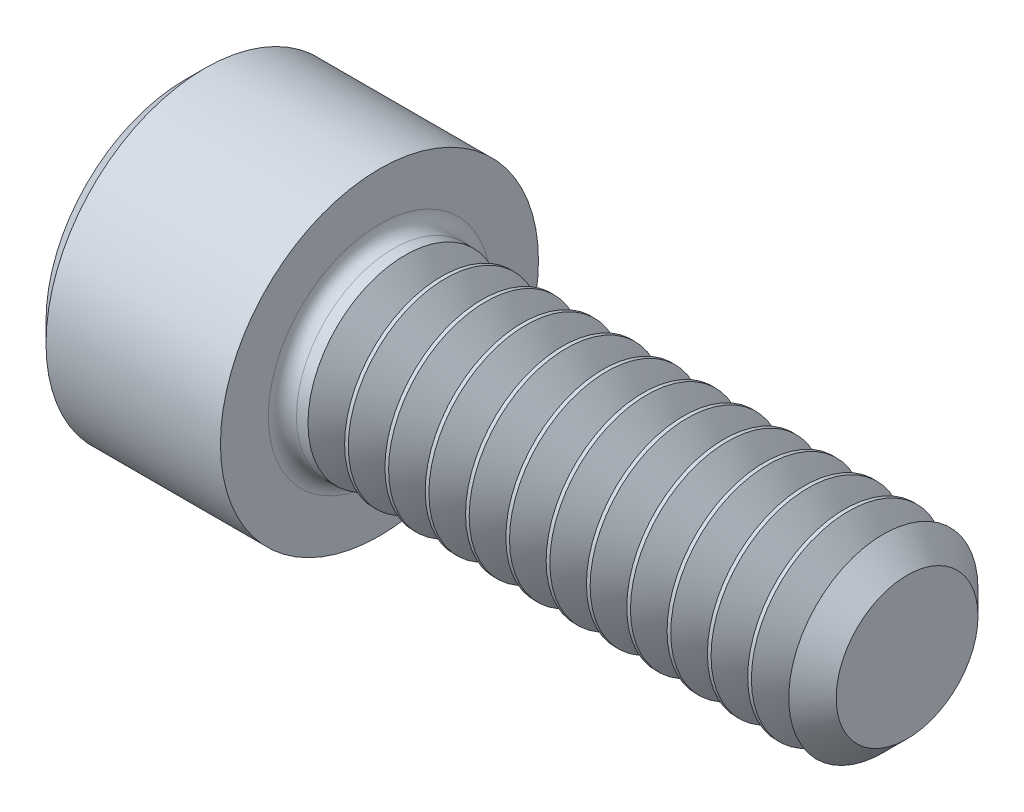
from build123d import *

# Parameters (mm, degrees)
SKETCH1_W            = 3.5052
SKETCH1_H            = 2.8702
SKETCH2_R            = 1.7526
BOSS_EXTRUDE1_DEPTH  = 0.461673951
SKETCH3_R            = 1.7526
BOSS_EXTRUDE2_DEPTH  = 0.330806049
BOSS_EXTRUDE2_TAPER  = 54.999999998
SKETCH4_R            = 1.28016
BOSS_EXTRUDE3_DEPTH  = 0.330806049
BOSS_EXTRUDE3_DRAFT  = -55
SKETCH5_R            = 1.7526
BOSS_EXTRUDE4_DEPTH  = 0.066097901
SKETCH6_R            = 1.7526
BOSS_EXTRUDE5_DEPTH  = 0.330806049
BOSS_EXTRUDE5_TAPER  = 54.999999998
SKETCH7_R            = 1.28016
BOSS_EXTRUDE6_DEPTH  = 0.330806049
BOSS_EXTRUDE6_DRAFT  = -55
SKETCH8_R            = 1.7526
BOSS_EXTRUDE7_DEPTH  = 0.066097901
SKETCH9_R            = 1.7526
BOSS_EXTRUDE8_DEPTH  = 0.330806049
BOSS_EXTRUDE8_TAPER  = 54.999999998
SKETCH10_R           = 1.28016
BOSS_EXTRUDE9_DEPTH  = 0.330806049
BOSS_EXTRUDE9_DRAFT  = -55
SKETCH11_R           = 1.7526
BOSS_EXTRUDE10_DEPTH = 0.066097901
SKETCH12_R           = 1.7526
BOSS_EXTRUDE11_DEPTH = 0.330806049
BOSS_EXTRUDE11_TAPER = 54.999999998
SKETCH13_R           = 1.28016
BOSS_EXTRUDE12_DEPTH = 0.330806049
BOSS_EXTRUDE12_DRAFT = -55
SKETCH14_R           = 1.7526
BOSS_EXTRUDE13_DEPTH = 0.066097901
SKETCH15_R           = 1.7526
BOSS_EXTRUDE14_DEPTH = 0.330806049
BOSS_EXTRUDE14_TAPER = 54.999999998
SKETCH16_R           = 1.28016
BOSS_EXTRUDE15_DEPTH = 0.330806049
BOSS_EXTRUDE15_DRAFT = -55
SKETCH17_R           = 1.7526
BOSS_EXTRUDE16_DEPTH = 0.066097901
SKETCH18_R           = 1.7526
BOSS_EXTRUDE17_DEPTH = 0.330806049
BOSS_EXTRUDE17_TAPER = 54.999999998
SKETCH19_R           = 1.28016
BOSS_EXTRUDE18_DEPTH = 0.330806049
BOSS_EXTRUDE18_DRAFT = -55
SKETCH20_R           = 1.7526
BOSS_EXTRUDE19_DEPTH = 0.066097901
SKETCH21_R           = 1.7526
BOSS_EXTRUDE20_DEPTH = 0.330806049
BOSS_EXTRUDE20_TAPER = 54.999999998
SKETCH22_R           = 1.28016
BOSS_EXTRUDE21_DEPTH = 0.330806049
BOSS_EXTRUDE21_DRAFT = -55
SKETCH23_R           = 1.7526
BOSS_EXTRUDE22_DEPTH = 0.066097901
SKETCH24_R           = 1.7526
BOSS_EXTRUDE23_DEPTH = 0.330806049
BOSS_EXTRUDE23_TAPER = 54.999999998
SKETCH25_R           = 1.28016
BOSS_EXTRUDE24_DEPTH = 0.330806049
BOSS_EXTRUDE24_DRAFT = -55.000000004
SKETCH26_R           = 1.7526
BOSS_EXTRUDE25_DEPTH = 0.066097901
SKETCH27_R           = 1.7526
BOSS_EXTRUDE26_DEPTH = 0.330806049
BOSS_EXTRUDE26_TAPER = 54.999999998
SKETCH28_R           = 1.28016
BOSS_EXTRUDE27_DEPTH = 0.330806049
BOSS_EXTRUDE27_DRAFT = -55
SKETCH29_R           = 1.7526
BOSS_EXTRUDE28_DEPTH = 0.066097901
SKETCH30_R           = 1.7526
BOSS_EXTRUDE29_DEPTH = 0.330806049
BOSS_EXTRUDE29_TAPER = 54.999999998
SKETCH31_R           = 1.28016
BOSS_EXTRUDE30_DEPTH = 0.330806049
BOSS_EXTRUDE30_DRAFT = -55.000000004
SKETCH32_R           = 1.7526
BOSS_EXTRUDE31_DEPTH = 0.066097901
SKETCH33_R           = 1.7526
BOSS_EXTRUDE32_DEPTH = 0.330806049
BOSS_EXTRUDE32_TAPER = 54.999999998
SKETCH34_R           = 1.28016
BOSS_EXTRUDE33_DEPTH = 0.330806049
BOSS_EXTRUDE33_DRAFT = -55.000000004
SKETCH35_R           = 1.7526
BOSS_EXTRUDE34_DEPTH = 0.066097901
SKETCH36_R           = 1.7526
BOSS_EXTRUDE35_DEPTH = 0.330806049
BOSS_EXTRUDE35_TAPER = 54.999999998
SKETCH37_R           = 1.28016
BOSS_EXTRUDE36_DEPTH = 0.299697546
BOSS_EXTRUDE36_DRAFT = -55.000000002
SKETCH38_R           = 1.708172454
BOSS_EXTRUDE37_DEPTH = 0.428012454
BOSS_EXTRUDE37_TAPER = 45
CUT_EXTRUDE1_DEPTH   = 1.6256
CHAMFER1_SIZE        = 0.3556
FILLET1_R            = 0.254


with BuildPart() as part:
    # Sketch1 → Revolve1 (revolve)
    with BuildSketch(Plane(origin=(0, 0, 0), x_dir=(-1, 0, 0), z_dir=(0, 0, -1)), mode=Mode.PRIVATE) as revolve1_sk:
        with Locations((-1.7526, 1.4351)):
            Rectangle(SKETCH1_W, SKETCH1_H)
    revolve(revolve1_sk.sketch.rotate(Axis((3.5052, 0, 0), (-1, 0, 0)), 270), axis=Axis((3.5052, 0, 0), (-1, 0, 0)))

    # Sketch2 → Boss-Extrude1 (add)
    with BuildSketch(Plane(origin=(3.5052, 0, 0), x_dir=(0, 0, -1), z_dir=(1, 0, 0))):
        Circle(SKETCH2_R)
    extrude(amount=BOSS_EXTRUDE1_DEPTH)

    # Sketch3 → Boss-Extrude2 (add)
    with BuildSketch(Plane(origin=(3.966873951, 0, 0), x_dir=(0, 0, -1), z_dir=(1, 0, 0))):
        Circle(SKETCH3_R)
    extrude(amount=BOSS_EXTRUDE2_DEPTH, taper=BOSS_EXTRUDE2_TAPER)


with BuildPart() as boss_extrude3_tool:
    # Sketch4 → Boss-Extrude3 (with draft: the straight prism first)
    with BuildSketch(Plane(origin=(4.29768, 0, 0), x_dir=(0, 0, -1), z_dir=(1, 0, 0))):
        Circle(SKETCH4_R)
    extrude(amount=BOSS_EXTRUDE3_DEPTH)
    # Boss-Extrude3: the draft: its side faces are tilted about the plane it starts from
    boss_extrude3_sides = [boss_extrude3_tool.faces().sort_by_distance(p)[0] for p in [
        (4.463083025, 0, 1.28016),
    ]]
    draft(boss_extrude3_sides, Plane(origin=(4.29768, 0, 0), x_dir=(0, 0, -1), z_dir=(1, 0, 0)), BOSS_EXTRUDE3_DRAFT)


with BuildPart() as part_1:
    add(part.part)

    # Boss-Extrude3: add boss_extrude3_tool
    add(boss_extrude3_tool.part)

    # Sketch5 → Boss-Extrude4 (add)
    with BuildSketch(Plane(origin=(4.628486049, 0, 0), x_dir=(0, 0, -1), z_dir=(1, 0, 0))):
        Circle(SKETCH5_R)
    extrude(amount=BOSS_EXTRUDE4_DEPTH)

    # Sketch6 → Boss-Extrude5 (add)
    with BuildSketch(Plane(origin=(4.694583951, 0, 0), x_dir=(0, 0, -1), z_dir=(1, 0, 0))):
        Circle(SKETCH6_R)
    extrude(amount=BOSS_EXTRUDE5_DEPTH, taper=BOSS_EXTRUDE5_TAPER)


with BuildPart() as boss_extrude6_tool:
    # Sketch7 → Boss-Extrude6 (with draft: the straight prism first)
    with BuildSketch(Plane(origin=(5.02539, 0, 0), x_dir=(0, 0, -1), z_dir=(1, 0, 0))):
        Circle(SKETCH7_R)
    extrude(amount=BOSS_EXTRUDE6_DEPTH)
    # Boss-Extrude6: the draft: its side faces are tilted about the plane it starts from
    boss_extrude6_sides = [boss_extrude6_tool.faces().sort_by_distance(p)[0] for p in [
        (5.190793025, 0, 1.28016),
    ]]
    draft(boss_extrude6_sides, Plane(origin=(5.02539, 0, 0), x_dir=(0, 0, -1), z_dir=(1, 0, 0)), BOSS_EXTRUDE6_DRAFT)


with BuildPart() as part_2:
    add(part_1.part)

    # Boss-Extrude6: add boss_extrude6_tool
    add(boss_extrude6_tool.part)

    # Sketch8 → Boss-Extrude7 (add)
    with BuildSketch(Plane(origin=(5.356196049, 0, 0), x_dir=(0, 0, -1), z_dir=(1, 0, 0))):
        Circle(SKETCH8_R)
    extrude(amount=BOSS_EXTRUDE7_DEPTH)

    # Sketch9 → Boss-Extrude8 (add)
    with BuildSketch(Plane(origin=(5.422293951, 0, 0), x_dir=(0, 0, -1), z_dir=(1, 0, 0))):
        Circle(SKETCH9_R)
    extrude(amount=BOSS_EXTRUDE8_DEPTH, taper=BOSS_EXTRUDE8_TAPER)


with BuildPart() as boss_extrude9_tool:
    # Sketch10 → Boss-Extrude9 (with draft: the straight prism first)
    with BuildSketch(Plane(origin=(5.7531, 0, 0), x_dir=(0, 0, -1), z_dir=(1, 0, 0))):
        Circle(SKETCH10_R)
    extrude(amount=BOSS_EXTRUDE9_DEPTH)
    # Boss-Extrude9: the draft: its side faces are tilted about the plane it starts from
    boss_extrude9_sides = [boss_extrude9_tool.faces().sort_by_distance(p)[0] for p in [
        (5.918503025, 0, 1.28016),
    ]]
    draft(boss_extrude9_sides, Plane(origin=(5.7531, 0, 0), x_dir=(0, 0, -1), z_dir=(1, 0, 0)), BOSS_EXTRUDE9_DRAFT)


with BuildPart() as part_3:
    add(part_2.part)

    # Boss-Extrude9: add boss_extrude9_tool
    add(boss_extrude9_tool.part)

    # Sketch11 → Boss-Extrude10 (add)
    with BuildSketch(Plane(origin=(6.083906049, 0, 0), x_dir=(0, 0, -1), z_dir=(1, 0, 0))):
        Circle(SKETCH11_R)
    extrude(amount=BOSS_EXTRUDE10_DEPTH)

    # Sketch12 → Boss-Extrude11 (add)
    with BuildSketch(Plane(origin=(6.150003951, 0, 0), x_dir=(0, 0, -1), z_dir=(1, 0, 0))):
        Circle(SKETCH12_R)
    extrude(amount=BOSS_EXTRUDE11_DEPTH, taper=BOSS_EXTRUDE11_TAPER)


with BuildPart() as boss_extrude12_tool:
    # Sketch13 → Boss-Extrude12 (with draft: the straight prism first)
    with BuildSketch(Plane(origin=(6.48081, 0, 0), x_dir=(0, 0, -1), z_dir=(1, 0, 0))):
        Circle(SKETCH13_R)
    extrude(amount=BOSS_EXTRUDE12_DEPTH)
    # Boss-Extrude12: the draft: its side faces are tilted about the plane it starts from
    boss_extrude12_sides = [boss_extrude12_tool.faces().sort_by_distance(p)[0] for p in [
        (6.646213025, 0, 1.28016),
    ]]
    draft(boss_extrude12_sides, Plane(origin=(6.48081, 0, 0), x_dir=(0, 0, -1), z_dir=(1, 0, 0)), BOSS_EXTRUDE12_DRAFT)


with BuildPart() as part_4:
    add(part_3.part)

    # Boss-Extrude12: add boss_extrude12_tool
    add(boss_extrude12_tool.part)

    # Sketch14 → Boss-Extrude13 (add)
    with BuildSketch(Plane(origin=(6.811616049, 0, 0), x_dir=(0, 0, -1), z_dir=(1, 0, 0))):
        Circle(SKETCH14_R)
    extrude(amount=BOSS_EXTRUDE13_DEPTH)

    # Sketch15 → Boss-Extrude14 (add)
    with BuildSketch(Plane(origin=(6.877713951, 0, 0), x_dir=(0, 0, -1), z_dir=(1, 0, 0))):
        Circle(SKETCH15_R)
    extrude(amount=BOSS_EXTRUDE14_DEPTH, taper=BOSS_EXTRUDE14_TAPER)


with BuildPart() as boss_extrude15_tool:
    # Sketch16 → Boss-Extrude15 (with draft: the straight prism first)
    with BuildSketch(Plane(origin=(7.20852, 0, 0), x_dir=(0, 0, -1), z_dir=(1, 0, 0))):
        Circle(SKETCH16_R)
    extrude(amount=BOSS_EXTRUDE15_DEPTH)
    # Boss-Extrude15: the draft: its side faces are tilted about the plane it starts from
    boss_extrude15_sides = [boss_extrude15_tool.faces().sort_by_distance(p)[0] for p in [
        (7.373923025, 0, 1.28016),
    ]]
    draft(boss_extrude15_sides, Plane(origin=(7.20852, 0, 0), x_dir=(0, 0, -1), z_dir=(1, 0, 0)), BOSS_EXTRUDE15_DRAFT)


with BuildPart() as part_5:
    add(part_4.part)

    # Boss-Extrude15: add boss_extrude15_tool
    add(boss_extrude15_tool.part)

    # Sketch17 → Boss-Extrude16 (add)
    with BuildSketch(Plane(origin=(7.539326049, 0, 0), x_dir=(0, 0, -1), z_dir=(1, 0, 0))):
        Circle(SKETCH17_R)
    extrude(amount=BOSS_EXTRUDE16_DEPTH)

    # Sketch18 → Boss-Extrude17 (add)
    with BuildSketch(Plane(origin=(7.605423951, 0, 0), x_dir=(0, 0, -1), z_dir=(1, 0, 0))):
        Circle(SKETCH18_R)
    extrude(amount=BOSS_EXTRUDE17_DEPTH, taper=BOSS_EXTRUDE17_TAPER)


with BuildPart() as boss_extrude18_tool:
    # Sketch19 → Boss-Extrude18 (with draft: the straight prism first)
    with BuildSketch(Plane(origin=(7.93623, 0, 0), x_dir=(0, 0, -1), z_dir=(1, 0, 0))):
        Circle(SKETCH19_R)
    extrude(amount=BOSS_EXTRUDE18_DEPTH)
    # Boss-Extrude18: the draft: its side faces are tilted about the plane it starts from
    boss_extrude18_sides = [boss_extrude18_tool.faces().sort_by_distance(p)[0] for p in [
        (8.101633025, 0, 1.28016),
    ]]
    draft(boss_extrude18_sides, Plane(origin=(7.93623, 0, 0), x_dir=(0, 0, -1), z_dir=(1, 0, 0)), BOSS_EXTRUDE18_DRAFT)


with BuildPart() as part_6:
    add(part_5.part)

    # Boss-Extrude18: add boss_extrude18_tool
    add(boss_extrude18_tool.part)

    # Sketch20 → Boss-Extrude19 (add)
    with BuildSketch(Plane(origin=(8.267036049, 0, 0), x_dir=(0, 0, -1), z_dir=(1, 0, 0))):
        Circle(SKETCH20_R)
    extrude(amount=BOSS_EXTRUDE19_DEPTH)

    # Sketch21 → Boss-Extrude20 (add)
    with BuildSketch(Plane(origin=(8.333133951, 0, 0), x_dir=(0, 0, -1), z_dir=(1, 0, 0))):
        Circle(SKETCH21_R)
    extrude(amount=BOSS_EXTRUDE20_DEPTH, taper=BOSS_EXTRUDE20_TAPER)


with BuildPart() as boss_extrude21_tool:
    # Sketch22 → Boss-Extrude21 (with draft: the straight prism first)
    with BuildSketch(Plane(origin=(8.66394, 0, 0), x_dir=(0, 0, -1), z_dir=(1, 0, 0))):
        Circle(SKETCH22_R)
    extrude(amount=BOSS_EXTRUDE21_DEPTH)
    # Boss-Extrude21: the draft: its side faces are tilted about the plane it starts from
    boss_extrude21_sides = [boss_extrude21_tool.faces().sort_by_distance(p)[0] for p in [
        (8.829343025, 0, 1.28016),
    ]]
    draft(boss_extrude21_sides, Plane(origin=(8.66394, 0, 0), x_dir=(0, 0, -1), z_dir=(1, 0, 0)), BOSS_EXTRUDE21_DRAFT)


with BuildPart() as part_7:
    add(part_6.part)

    # Boss-Extrude21: add boss_extrude21_tool
    add(boss_extrude21_tool.part)

    # Sketch23 → Boss-Extrude22 (add)
    with BuildSketch(Plane(origin=(8.994746049, 0, 0), x_dir=(0, 0, -1), z_dir=(1, 0, 0))):
        Circle(SKETCH23_R)
    extrude(amount=BOSS_EXTRUDE22_DEPTH)

    # Sketch24 → Boss-Extrude23 (add)
    with BuildSketch(Plane(origin=(9.060843951, 0, 0), x_dir=(0, 0, -1), z_dir=(1, 0, 0))):
        Circle(SKETCH24_R)
    extrude(amount=BOSS_EXTRUDE23_DEPTH, taper=BOSS_EXTRUDE23_TAPER)


with BuildPart() as boss_extrude24_tool:
    # Sketch25 → Boss-Extrude24 (with draft: the straight prism first)
    with BuildSketch(Plane(origin=(9.39165, 0, 0), x_dir=(0, 0, -1), z_dir=(1, 0, 0))):
        Circle(SKETCH25_R)
    extrude(amount=BOSS_EXTRUDE24_DEPTH)
    # Boss-Extrude24: the draft: its side faces are tilted about the plane it starts from
    boss_extrude24_sides = [boss_extrude24_tool.faces().sort_by_distance(p)[0] for p in [
        (9.557053025, 0, 1.28016),
    ]]
    draft(boss_extrude24_sides, Plane(origin=(9.39165, 0, 0), x_dir=(0, 0, -1), z_dir=(1, 0, 0)), BOSS_EXTRUDE24_DRAFT)


with BuildPart() as part_8:
    add(part_7.part)

    # Boss-Extrude24: add boss_extrude24_tool
    add(boss_extrude24_tool.part)

    # Sketch26 → Boss-Extrude25 (add)
    with BuildSketch(Plane(origin=(9.722456049, 0, 0), x_dir=(0, 0, -1), z_dir=(1, 0, 0))):
        Circle(SKETCH26_R)
    extrude(amount=BOSS_EXTRUDE25_DEPTH)

    # Sketch27 → Boss-Extrude26 (add)
    with BuildSketch(Plane(origin=(9.788553951, 0, 0), x_dir=(0, 0, -1), z_dir=(1, 0, 0))):
        Circle(SKETCH27_R)
    extrude(amount=BOSS_EXTRUDE26_DEPTH, taper=BOSS_EXTRUDE26_TAPER)


with BuildPart() as boss_extrude27_tool:
    # Sketch28 → Boss-Extrude27 (with draft: the straight prism first)
    with BuildSketch(Plane(origin=(10.11936, 0, 0), x_dir=(0, 0, -1), z_dir=(1, 0, 0))):
        Circle(SKETCH28_R)
    extrude(amount=BOSS_EXTRUDE27_DEPTH)
    # Boss-Extrude27: the draft: its side faces are tilted about the plane it starts from
    boss_extrude27_sides = [boss_extrude27_tool.faces().sort_by_distance(p)[0] for p in [
        (10.284763025, 0, 1.28016),
    ]]
    draft(boss_extrude27_sides, Plane(origin=(10.11936, 0, 0), x_dir=(0, 0, -1), z_dir=(1, 0, 0)), BOSS_EXTRUDE27_DRAFT)


with BuildPart() as part_9:
    add(part_8.part)

    # Boss-Extrude27: add boss_extrude27_tool
    add(boss_extrude27_tool.part)

    # Sketch29 → Boss-Extrude28 (add)
    with BuildSketch(Plane(origin=(10.450166049, 0, 0), x_dir=(0, 0, -1), z_dir=(1, 0, 0))):
        Circle(SKETCH29_R)
    extrude(amount=BOSS_EXTRUDE28_DEPTH)

    # Sketch30 → Boss-Extrude29 (add)
    with BuildSketch(Plane(origin=(10.516263951, 0, 0), x_dir=(0, 0, -1), z_dir=(1, 0, 0))):
        Circle(SKETCH30_R)
    extrude(amount=BOSS_EXTRUDE29_DEPTH, taper=BOSS_EXTRUDE29_TAPER)


with BuildPart() as boss_extrude30_tool:
    # Sketch31 → Boss-Extrude30 (with draft: the straight prism first)
    with BuildSketch(Plane(origin=(10.84707, 0, 0), x_dir=(0, 0, -1), z_dir=(1, 0, 0))):
        Circle(SKETCH31_R)
    extrude(amount=BOSS_EXTRUDE30_DEPTH)
    # Boss-Extrude30: the draft: its side faces are tilted about the plane it starts from
    boss_extrude30_sides = [boss_extrude30_tool.faces().sort_by_distance(p)[0] for p in [
        (11.012473025, 0, 1.28016),
    ]]
    draft(boss_extrude30_sides, Plane(origin=(10.84707, 0, 0), x_dir=(0, 0, -1), z_dir=(1, 0, 0)), BOSS_EXTRUDE30_DRAFT)


with BuildPart() as part_10:
    add(part_9.part)

    # Boss-Extrude30: add boss_extrude30_tool
    add(boss_extrude30_tool.part)

    # Sketch32 → Boss-Extrude31 (add)
    with BuildSketch(Plane(origin=(11.177876049, 0, 0), x_dir=(0, 0, -1), z_dir=(1, 0, 0))):
        Circle(SKETCH32_R)
    extrude(amount=BOSS_EXTRUDE31_DEPTH)

    # Sketch33 → Boss-Extrude32 (add)
    with BuildSketch(Plane(origin=(11.243973951, 0, 0), x_dir=(0, 0, -1), z_dir=(1, 0, 0))):
        Circle(SKETCH33_R)
    extrude(amount=BOSS_EXTRUDE32_DEPTH, taper=BOSS_EXTRUDE32_TAPER)


with BuildPart() as boss_extrude33_tool:
    # Sketch34 → Boss-Extrude33 (with draft: the straight prism first)
    with BuildSketch(Plane(origin=(11.57478, 0, 0), x_dir=(0, 0, -1), z_dir=(1, 0, 0))):
        Circle(SKETCH34_R)
    extrude(amount=BOSS_EXTRUDE33_DEPTH)
    # Boss-Extrude33: the draft: its side faces are tilted about the plane it starts from
    boss_extrude33_sides = [boss_extrude33_tool.faces().sort_by_distance(p)[0] for p in [
        (11.740183025, 0, 1.28016),
    ]]
    draft(boss_extrude33_sides, Plane(origin=(11.57478, 0, 0), x_dir=(0, 0, -1), z_dir=(1, 0, 0)), BOSS_EXTRUDE33_DRAFT)


with BuildPart() as part_11:
    add(part_10.part)

    # Boss-Extrude33: add boss_extrude33_tool
    add(boss_extrude33_tool.part)

    # Sketch35 → Boss-Extrude34 (add)
    with BuildSketch(Plane(origin=(11.905586049, 0, 0), x_dir=(0, 0, -1), z_dir=(1, 0, 0))):
        Circle(SKETCH35_R)
    extrude(amount=BOSS_EXTRUDE34_DEPTH)

    # Sketch36 → Boss-Extrude35 (add)
    with BuildSketch(Plane(origin=(11.971683951, 0, 0), x_dir=(0, 0, -1), z_dir=(1, 0, 0))):
        Circle(SKETCH36_R)
    extrude(amount=BOSS_EXTRUDE35_DEPTH, taper=BOSS_EXTRUDE35_TAPER)


with BuildPart() as boss_extrude36_tool:
    # Sketch37 → Boss-Extrude36 (with draft: the straight prism first)
    with BuildSketch(Plane(origin=(12.30249, 0, 0), x_dir=(0, 0, -1), z_dir=(1, 0, 0))):
        Circle(SKETCH37_R)
    extrude(amount=BOSS_EXTRUDE36_DEPTH)
    # Boss-Extrude36: the draft: its side faces are tilted about the plane it starts from
    boss_extrude36_sides = [boss_extrude36_tool.faces().sort_by_distance(p)[0] for p in [
        (12.452338773, 0, 1.28016),
    ]]
    draft(boss_extrude36_sides, Plane(origin=(12.30249, 0, 0), x_dir=(0, 0, -1), z_dir=(1, 0, 0)), BOSS_EXTRUDE36_DRAFT)


with BuildPart() as part_12:
    add(part_11.part)

    # Boss-Extrude36: add boss_extrude36_tool
    add(boss_extrude36_tool.part)

    # Sketch38 → Boss-Extrude37 (add)
    with BuildSketch(Plane(origin=(12.602187546, 0, 0), x_dir=(0, 0, -1), z_dir=(1, 0, 0))):
        Circle(SKETCH38_R)
    extrude(amount=BOSS_EXTRUDE37_DEPTH, taper=BOSS_EXTRUDE37_TAPER)

    # Sketch39 → Cut-Extrude1 (cut)
    with BuildSketch(Plane.ZY):
        Polygon((-1.3843, -0.799225978), (0, -1.598451955), (1.3843, -0.799225978), (1.3843, 0.799225978), (0, 1.598451955), (-1.3843, 0.799225978), align=None)
    extrude(amount=-CUT_EXTRUDE1_DEPTH, mode=Mode.SUBTRACT)

    # Sketch40 → Cut-Revolve1 (revolve, cut)
    with BuildSketch(Plane.XY, mode=Mode.PRIVATE) as cut_revolve1_sk:
        Polygon((1.6256, 1.3843), (1.6256, 0), (2.424825978, 0), align=None)
    revolve(cut_revolve1_sk.sketch.rotate(Axis((1.625575, 0, 0), (1, 0, 0)), 90), axis=Axis((1.625575, 0, 0), (1, 0, 0)), mode=Mode.SUBTRACT)

    # Chamfer1
    chamfer1_edges = [part_12.edges().sort_by_distance(p)[0] for p in [
        (0, 0, -2.8702),
    ]]
    chamfer(chamfer1_edges, length=CHAMFER1_SIZE)

    # Fillet1
    fillet1_edges = [part_12.edges().sort_by_distance(p)[0] for p in [
        (3.5052, 0, 1.7526),
    ]]
    fillet(fillet1_edges, radius=FILLET1_R)


solid = part_12.part
